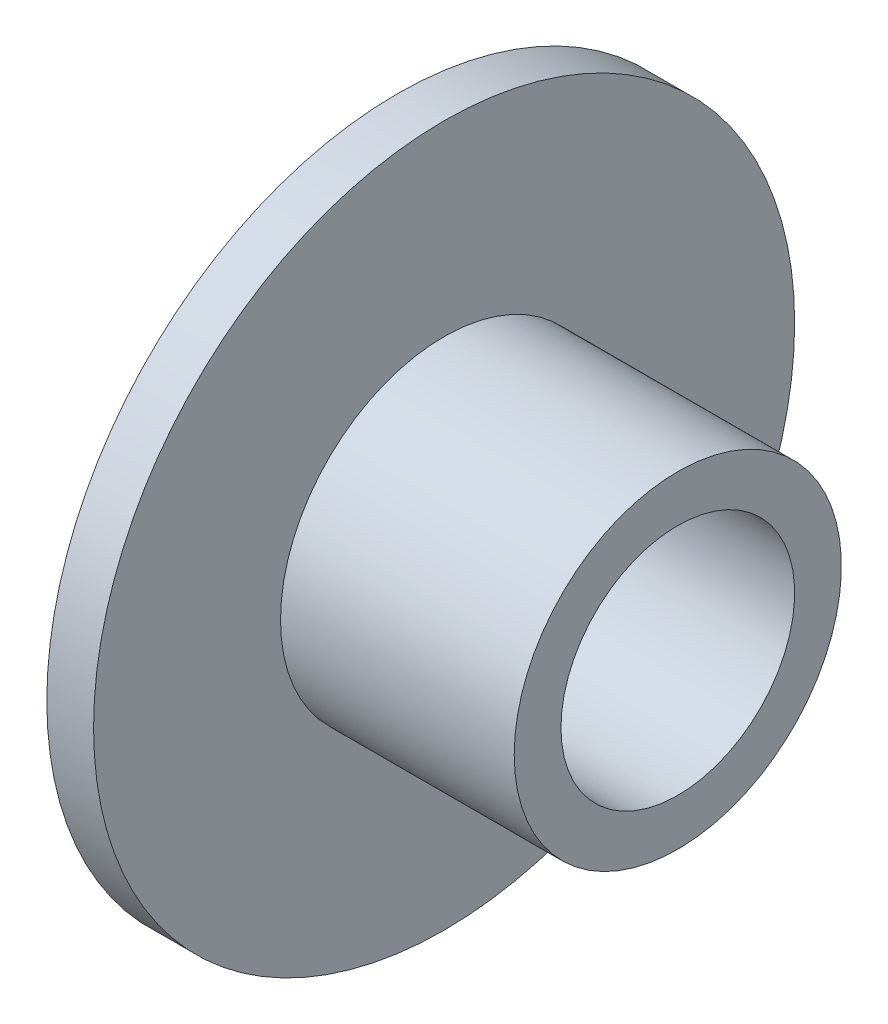
from build123d import *


with BuildPart() as part:
    # Sketch2 → Revolve1 (revolve)
    with BuildSketch(Plane(origin=(0, 0, 0), x_dir=(1, 0, 0), z_dir=(0, 1, 0)), mode=Mode.PRIVATE) as revolve1_sk:
        Polygon((22.585966847, 17.434015501), (24.585966847, 17.434015501), (24.585966847, 9.434015501), (34.585966847, 9.434015501), (34.585966847, 7.434015501), (22.585966847, 7.434015501), (22.585966847, 15.434015501), align=None)
    revolve(revolve1_sk.sketch.rotate(Axis((22.585966847, 0, -2.434015501), (1, 0, 0)), 180), axis=Axis((22.585966847, 0, -2.434015501), (1, 0, 0)))


solid = part.part
